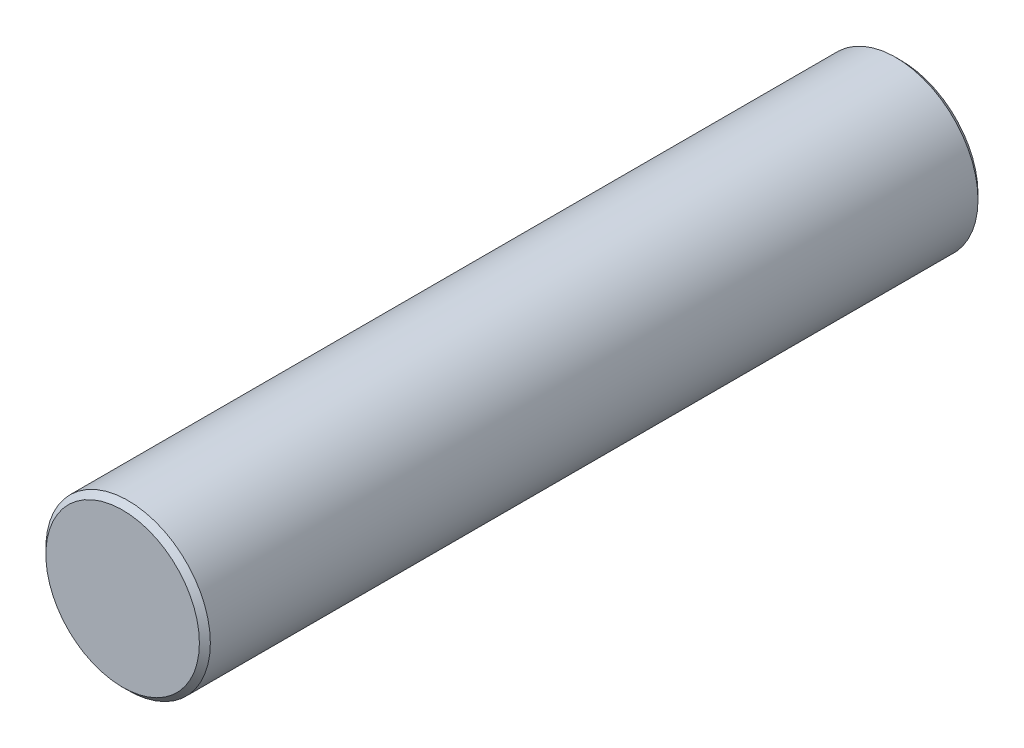
from build123d import *

# Parameters (mm, degrees)
SKETCH1_R           = 3
BOSS_EXTRUDE1_DEPTH = 14.2
CHAMFER1_SIZE       = 0.2


with BuildPart() as part:
    # Sketch1 → Boss-Extrude1 (new, symmetric)
    with BuildSketch(Plane(origin=(0, 0, 0), x_dir=(0, 1, 0), z_dir=(0, 0, 1))):
        with Locations(Location((0, 0, 0), (0, 0, 270))):
            Circle(SKETCH1_R)
    extrude(amount=BOSS_EXTRUDE1_DEPTH, both=True)

    # Chamfer1
    chamfer1_edges = [part.edges().sort_by_distance(p)[0] for p in [
        (-3, 0, -14.2),
        (-3, 0, 14.2),
    ]]
    chamfer(chamfer1_edges, length=CHAMFER1_SIZE)


solid = part.part
